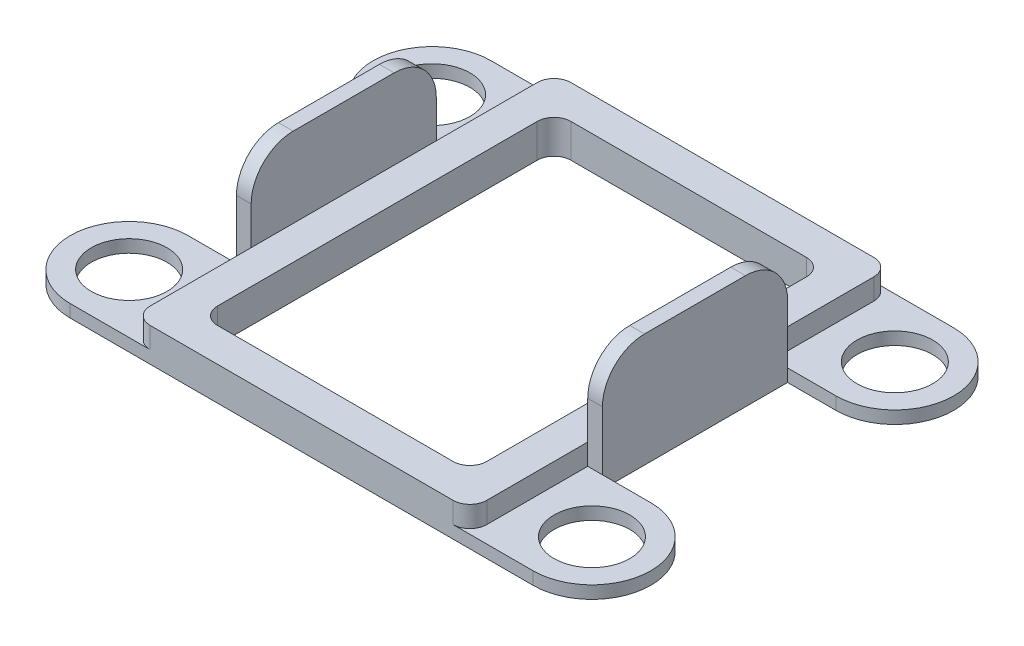
from build123d import *

# Parameters (mm, degrees)
SKETCH1_R               = 4.5
BOSS_EXTRUDE1_DEPTH     = 1.5
SKETCH2_W               = 1.75
SKETCH2_H               = 22
BOSS_EXTRUDE2_DEPTH     = 12
SKETCH3_W               = 40
SKETCH3_H               = 50
SKETCH3_W_2             = 32
SKETCH3_H_2             = 42
BOSS_EXTRUDE3_DEPTH     = 2.5
CUT_EXTRUDE1_DEPTH      = 45.263416045
CUT_EXTRUDE1_DEPTH_BACK = 45.263416045
SKETCH3_2_W             = 32
SKETCH3_2_H             = 42
FILLET1_R               = 2
FILLET2_R               = 2
FILLET3_R               = 5


with BuildPart() as part:
    # Sketch1 → Boss-Extrude1 (new body)
    with BuildSketch(Plane(origin=(0, 0, 0), x_dir=(1, 0, 0), z_dir=(0, 1, 0))):
        with BuildLine():
            Line((27.5, 25), (-27.5, 25))
            ThreePointArc((-27.5, 25), (-34.5, 18), (-27.5, 11))
            Line((-27.5, 11), (-21.75, 11))
            Line((-21.75, 11), (-21.75, -11))
            Line((-21.75, -11), (-27.5, -11))
            ThreePointArc((-27.5, -11), (-34.5, -18), (-27.5, -25))
            Line((-27.5, -25), (27.5, -25))
            ThreePointArc((27.5, -25), (34.5, -18), (27.5, -11))
            Line((27.5, -11), (21.75, -11))
            Line((21.75, -11), (21.75, 11))
            Line((21.75, 11), (27.5, 11))
            ThreePointArc((27.5, 11), (34.5, 18), (27.5, 25))
        make_face()
        with Locations((-27.5, -18)):
            Circle(SKETCH1_R, mode=Mode.SUBTRACT)
        with Locations((27.5, -18)):
            Circle(SKETCH1_R, mode=Mode.SUBTRACT)
        with Locations((-27.5, 18)):
            Circle(SKETCH1_R, mode=Mode.SUBTRACT)
        with Locations((27.5, 18)):
            Circle(SKETCH1_R, mode=Mode.SUBTRACT)
    extrude(amount=BOSS_EXTRUDE1_DEPTH)

    # Sketch2 → Boss-Extrude2 (add)
    with BuildSketch(Plane(origin=(0, 1.5, 0), x_dir=(1, 0, 0), z_dir=(0, 1, 0))):
        with Locations((-20.875, 0)):
            Rectangle(SKETCH2_W, SKETCH2_H)
        with Locations((20.875, 0)):
            Rectangle(SKETCH2_W, SKETCH2_H)
    extrude(amount=BOSS_EXTRUDE2_DEPTH)

    # Sketch3 → Boss-Extrude3 (add)
    with BuildSketch(Plane(origin=(0, 1.5, 0), x_dir=(1, 0, 0), z_dir=(0, 1, 0))):
        Rectangle(SKETCH3_W, SKETCH3_H)
        Rectangle(SKETCH3_W_2, SKETCH3_H_2, mode=Mode.SUBTRACT)
    extrude(amount=BOSS_EXTRUDE3_DEPTH)

    # Sketch3<2> → Cut-Extrude1 (cut, two sides: drawn at the far end of the back side and taken through both)
    with BuildSketch(Plane(origin=(0, 1.5, 0), x_dir=(1, 0, 0), z_dir=(0, 1, 0)).offset(-CUT_EXTRUDE1_DEPTH_BACK)):
        Rectangle(SKETCH3_2_W, SKETCH3_2_H)
    extrude(amount=CUT_EXTRUDE1_DEPTH + CUT_EXTRUDE1_DEPTH_BACK, mode=Mode.SUBTRACT)

    # Fillet1
    fillet1_edges = [part.edges().sort_by_distance(p)[0] for p in [
        (20, 2.75, -25),
        (20, 2.75, 25),
        (-20, 2.75, 25),
        (-20, 2.75, -25),
    ]]
    fillet(fillet1_edges, radius=FILLET1_R)

    # Fillet2
    fillet2_edges = [part.edges().sort_by_distance(p)[0] for p in [
        (-16, 2, 21),
        (16, 2, 21),
        (16, 2, -21),
        (-16, 2, -21),
    ]]
    fillet(fillet2_edges, radius=FILLET2_R)

    # Fillet3
    fillet3_edges = [part.edges().sort_by_distance(p)[0] for p in [
        (20.875, 13.5, -11),
        (20.875, 13.5, 11),
        (-20.875, 13.5, -11),
        (-20.875, 13.5, 11),
    ]]
    fillet(fillet3_edges, radius=FILLET3_R)


solid = part.part
